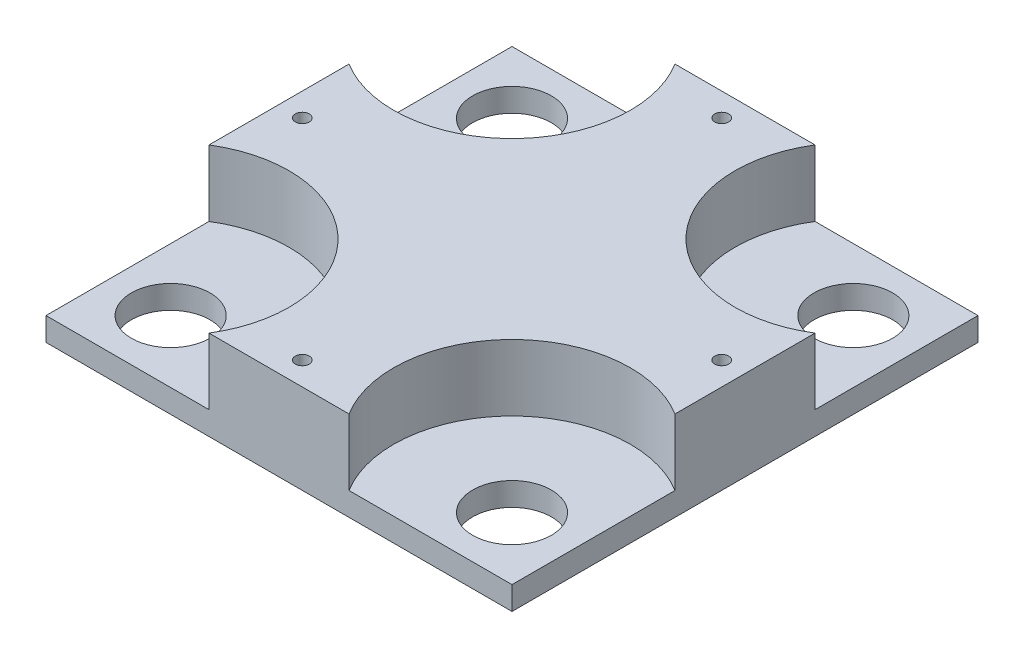
from build123d import *

# Parameters (mm, degrees)
SKETCH1_W               = 100
SKETCH1_H               = 100
SKETCH1_R               = 8.4375
BOSS_EXTRUDE1_DEPTH     = 19.224
SKETCH4_R               = 25.4
CUT_EXTRUDE2_DEPTH      = 14.224
CUT_EXTRUDE1_DEPTH      = 125.005416922
CUT_EXTRUDE1_DEPTH_BACK = 125.005416922
SKETCH3_R               = 1.5


with BuildPart() as part:
    # Sketch1 → Boss-Extrude1 (new body)
    with BuildSketch(Plane(origin=(0, 0, 0), x_dir=(1, 0, 0), z_dir=(0, 1, 0))):
        with Locations((36.625, 36.625)):
            Rectangle(SKETCH1_W, SKETCH1_H)
        with Locations(Location((0, 0, 0), (0, 0, 270))):
            Circle(SKETCH1_R, mode=Mode.SUBTRACT)
        with Locations(Location((0, 73.25, 0), (0, 0, 270))):
            Circle(SKETCH1_R, mode=Mode.SUBTRACT)
        with Locations(Location((73.25, 73.25, 0), (0, 0, 270))):
            Circle(SKETCH1_R, mode=Mode.SUBTRACT)
        with Locations(Location((73.25, 0, 0), (0, 0, 270))):
            Circle(SKETCH1_R, mode=Mode.SUBTRACT)
    extrude(amount=BOSS_EXTRUDE1_DEPTH)

    # Sketch4 → Cut-Extrude2 (cut)
    with BuildSketch(Plane(origin=(0, 19.224, 0), x_dir=(1, 0, 0), z_dir=(0, 1, 0))):
        Circle(SKETCH4_R)
        with Locations((73.25, 0)):
            Circle(SKETCH4_R)
        with Locations((73.25, 73.25)):
            Circle(SKETCH4_R)
        with Locations((0, 73.25)):
            Circle(SKETCH4_R)
    extrude(amount=-CUT_EXTRUDE2_DEPTH, mode=Mode.SUBTRACT)

    # Sketch3 → Cut-Extrude1 (cut, two sides: drawn at the far end of the back side and taken through both)
    with BuildSketch(Plane(origin=(0, 0, 0), x_dir=(1, 0, 0), z_dir=(0, 1, 0)).offset(-CUT_EXTRUDE1_DEPTH_BACK)):
        with Locations(Location((36.625, 81.625, 0), (0, 0, 270))):
            Circle(SKETCH3_R)
        with Locations(Location((81.625, 36.625, 0), (0, 0, 270))):
            Circle(SKETCH3_R)
        with Locations(Location((36.625, -8.375, 0), (0, 0, 270))):
            Circle(SKETCH3_R)
        with Locations(Location((-8.375, 36.625, 0), (0, 0, 270))):
            Circle(SKETCH3_R)
    extrude(amount=CUT_EXTRUDE1_DEPTH + CUT_EXTRUDE1_DEPTH_BACK, mode=Mode.SUBTRACT)


solid = part.part
